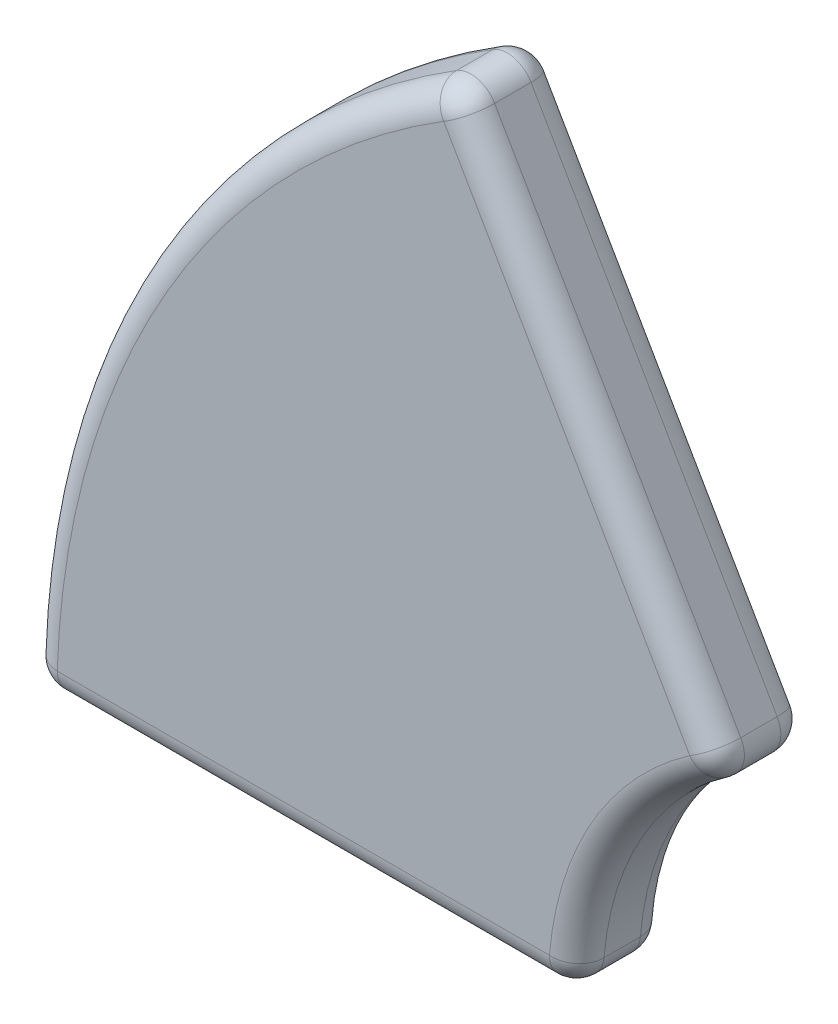
from build123d import *

# Parameters (mm, degrees)
BOSS_EXTRUDE1_DEPTH = 100
FILLET1_R           = 30


with BuildPart() as part:
    # Sketch1 → Boss-Extrude1 (new body)
    with BuildSketch(Plane.XY):
        with BuildLine():
            Line((-331.6, 0), (-931.6, 0))
            ThreePointArc((-931.6, 0), (-806.789266166, 465.8), (-465.8, 806.789266166))
            Line((-465.8, 806.789266166), (-165.8, 287.174023895))
            ThreePointArc((-165.8, 287.174023895), (-287.174023895, 165.8), (-331.6, 0))
        make_face()
    extrude(amount=BOSS_EXTRUDE1_DEPTH)

    # Fillet1
    fillet1_edges = [part.edges().sort_by_distance(p)[0] for p in [
        (-806.789266166, 465.8, 100),
        (-631.6, 0, 100),
        (-287.174023895, 165.8, 100),
        (-631.6, 0, 0),
        (-806.789266166, 465.8, 0),
        (-315.8, 546.98164503, 0),
        (-287.174023895, 165.8, 0),
        (-331.6, 0, 50),
        (-931.6, 0, 50),
        (-465.8, 806.789266166, 50),
        (-165.8, 287.174023895, 50),
        (-315.8, 546.98164503, 100),
    ]]
    fillet(fillet1_edges, radius=FILLET1_R)


solid = part.part
